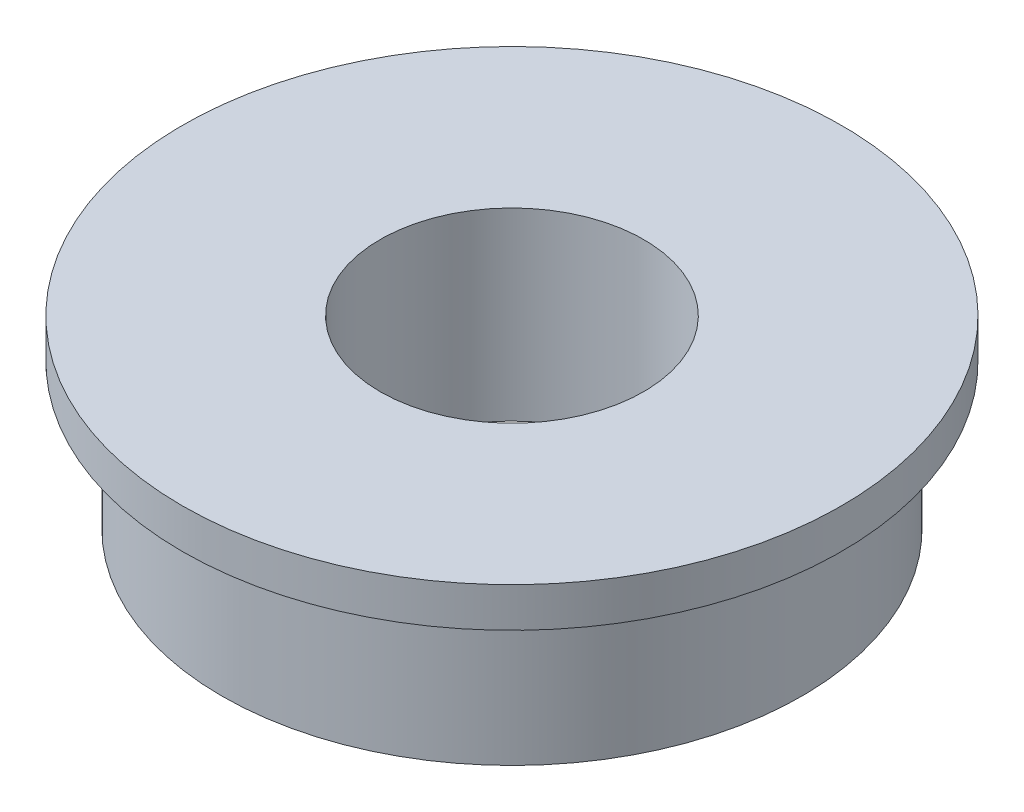
from build123d import *

# Parameters (mm, degrees)
SKETCH1_R           = 11
SKETCH1_R_2         = 5
BOSS_EXTRUDE1_DEPTH = 3.5
SKETCH2_R           = 12.5
SKETCH2_R_2         = 11
BOSS_EXTRUDE2_DEPTH = 1.5


with BuildPart() as part:
    # Sketch1 → Boss-Extrude1 (new, symmetric)
    with BuildSketch(Plane(origin=(0, 0, 0), x_dir=(1, 0, 0), z_dir=(0, 1, 0))):
        with Locations(Location((0, 0, 0), (0, 0, 270))):
            Circle(SKETCH1_R)
        with Locations(Location((0, 0, 0), (0, 0, 270))):
            Circle(SKETCH1_R_2, mode=Mode.SUBTRACT)
    extrude(amount=BOSS_EXTRUDE1_DEPTH, both=True)

    # Sketch2 → Boss-Extrude2 (add)
    with BuildSketch(Plane(origin=(0, 3.5, 0), x_dir=(1, 0, 0), z_dir=(0, 1, 0))):
        with Locations(Location((0, 0, 0), (0, 0, 270))):
            Circle(SKETCH2_R)
        with Locations(Location((0, 0, 0), (0, 0, 270))):
            Circle(SKETCH2_R_2, mode=Mode.SUBTRACT)
    extrude(amount=-BOSS_EXTRUDE2_DEPTH)


solid = part.part
